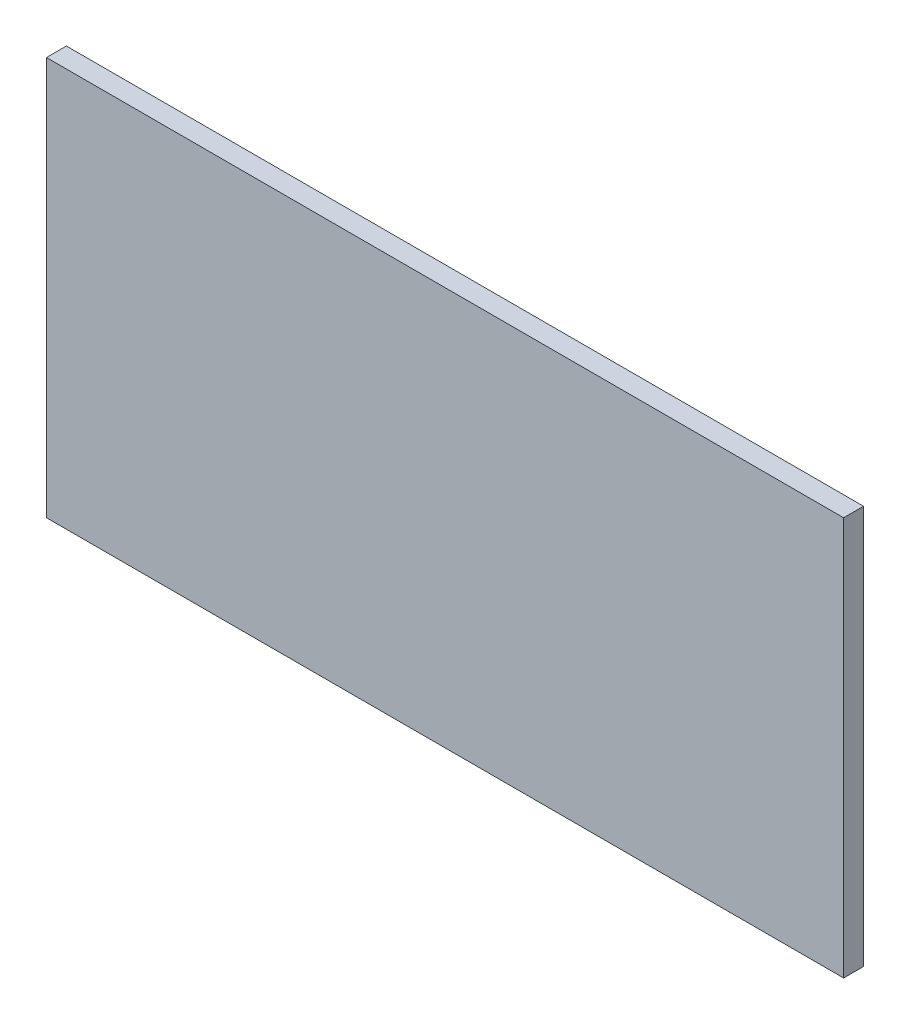
from build123d import *

# Parameters (mm, degrees)
SKETCH1_W           = 1000
SKETCH1_H           = 500
BOSS_EXTRUDE1_DEPTH = 25


with BuildPart() as part:
    # Sketch1 → Boss-Extrude1 (new body)
    with BuildSketch(Plane.XY):
        with Locations((500, 250)):
            Rectangle(SKETCH1_W, SKETCH1_H)
    extrude(amount=BOSS_EXTRUDE1_DEPTH)


solid = part.part
